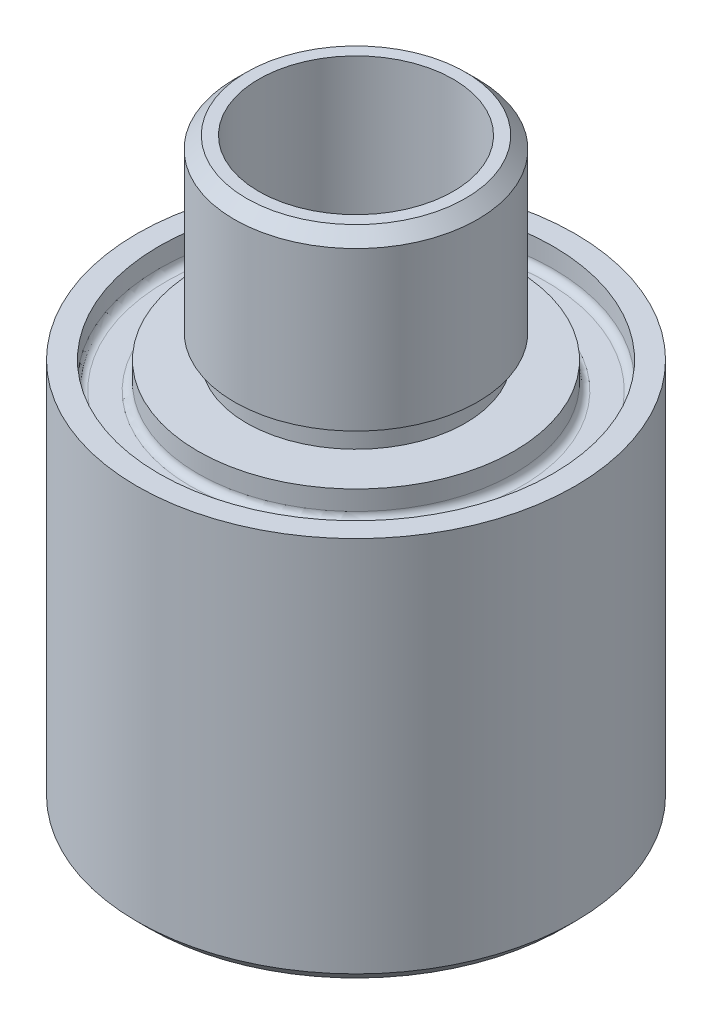
from build123d import *

# Parameters (mm, degrees)
SKETCH_1_R          = 9
EXTRUDE_1_DEPTH     = 16
SKETCH_2_R          = 7.5
CUT_EXTRUDE_1_DEPTH = 12.5
SKETCH_4_R          = 4.5
EXTRUDE_2_DEPTH     = 1
SKETCH_5_R          = 5
EXTRUDE_3_DEPTH     = 7
SKETCH_6_R          = 8.1
SKETCH_6_R_2        = 6.5
CUT_EXTRUDE_2_DEPTH = 1.1
CHAMFER_1_SIZE      = 0.5
FILLET_1_R          = 0.3
SKETCH_15_R         = 4
CUT_EXTRUDE_4_DEPTH = 11.5
CHAMFER_4_SIZE      = 0.5
CHAMFER_5_SIZE      = 0.5


with BuildPart() as part:
    # 草图1 → 凸台-拉伸1 (new body)
    with BuildSketch(Plane(origin=(0, 0, 0), x_dir=(1, 0, 0), z_dir=(0, 1, 0))):
        with Locations(Location((0, 0, 0), (0, 0, 270))):
            Circle(SKETCH_1_R)
    extrude(amount=EXTRUDE_1_DEPTH)

    # 草图2 → 切除-拉伸1 (cut)
    with BuildSketch(Plane.XZ):
        with Locations(Location((0, 0, 0), (0, 0, 270))):
            Circle(SKETCH_2_R)
    extrude(amount=-CUT_EXTRUDE_1_DEPTH, mode=Mode.SUBTRACT)

    # 草图4 → 凸台-拉伸2 (add)
    with BuildSketch(Plane(origin=(0, 16, 0), x_dir=(1, 0, 0), z_dir=(0, 1, 0))):
        with Locations(Location((0, 0, 0), (0, 0, 270))):
            Circle(SKETCH_4_R)
    extrude(amount=EXTRUDE_2_DEPTH)

    # 草图5 → 凸台-拉伸3 (add)
    with BuildSketch(Plane(origin=(0, 17, 0), x_dir=(1, 0, 0), z_dir=(0, 1, 0))):
        with Locations(Location((0, 0, 0), (0, 0, 270))):
            Circle(SKETCH_5_R)
    extrude(amount=EXTRUDE_3_DEPTH)

    # 草图6 → 切除-拉伸2 (cut)
    with BuildSketch(Plane(origin=(0, 16, 0), x_dir=(1, 0, 0), z_dir=(0, 1, 0))):
        with Locations(Location((0, 0, 0), (0, 0, 270))):
            Circle(SKETCH_6_R)
        with Locations(Location((0, 0, 0), (0, 0, 270))):
            Circle(SKETCH_6_R_2, mode=Mode.SUBTRACT)
    extrude(amount=-CUT_EXTRUDE_2_DEPTH, mode=Mode.SUBTRACT)

    # 倒角1
    chamfer_1_edges = [part.edges().sort_by_distance(p)[0] for p in [
        (0, 24, -5),
    ]]
    chamfer(chamfer_1_edges, length=CHAMFER_1_SIZE)

    # 圆角1
    fillet_1_edges = [part.edges().sort_by_distance(p)[0] for p in [
        (0, 14.9, -8.1),
        (0, 14.9, -6.5),
    ]]
    fillet(fillet_1_edges, radius=FILLET_1_R)

    # 草图15 → 切除-拉伸4 (cut)
    with BuildSketch(Plane(origin=(0, 24, 0), x_dir=(1, 0, 0), z_dir=(0, 1, 0))):
        with Locations(Location((0, 0, 0), (0, 0, 270))):
            Circle(SKETCH_15_R)
    extrude(amount=-CUT_EXTRUDE_4_DEPTH, mode=Mode.SUBTRACT)

    # 倒角4
    chamfer_4_edges = [part.edges().sort_by_distance(p)[0] for p in [
        (0, 12.5, -4),
    ]]
    chamfer(chamfer_4_edges, length=CHAMFER_4_SIZE)

    # 倒角5
    chamfer_5_edges = [part.edges().sort_by_distance(p)[0] for p in [
        (0, 0, -9),
    ]]
    chamfer(chamfer_5_edges, length=CHAMFER_5_SIZE)


solid = part.part
